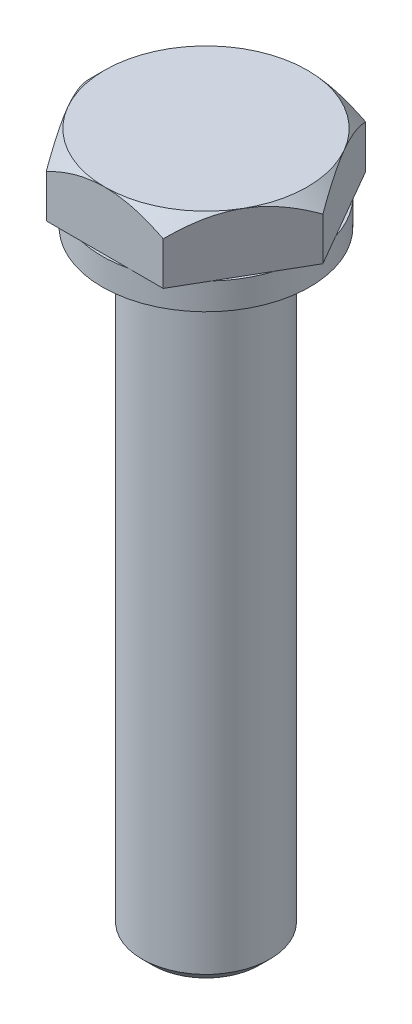
from build123d import *

# Parameters (mm, degrees)
SZKIC1_R                    = 6
DODANIE_WYCI_GNI_CIE1_DEPTH = 60
DODANIE_WYCI_GNI_CIE2_DEPTH = 5.5
SFAZOWANIE1_SIZE            = 1
SZKIC6_R                    = 9.75
SZKIC6_R_2                  = 6.5
DODANIE_WYCI_GNI_CIE3_DEPTH = 2.5


with BuildPart() as part:
    # Szkic1 → Dodanie-wyciągnięcie1 (new body)
    with BuildSketch(Plane(origin=(0, 0, 0), x_dir=(1, 0, 0), z_dir=(0, 1, 0))):
        with Locations(Location((0, 0, 0), (0, 0, 270))):
            Circle(SZKIC1_R)
    extrude(amount=-DODANIE_WYCI_GNI_CIE1_DEPTH)

    # Szkic2 → Dodanie-wyciągnięcie2 (add)
    with BuildSketch(Plane(origin=(0, 0, 0), x_dir=(1, 0, 0), z_dir=(0, 1, 0))):
        Polygon((10.969655115, 0), (5.484827557, 9.5), (-5.484827557, 9.5), (-10.969655115, 0), (-5.484827557, -9.5), (5.484827557, -9.5), align=None)
    extrude(amount=DODANIE_WYCI_GNI_CIE2_DEPTH)

    # Szkic4 → Wycięcie-obrót1 (revolve, cut)
    with BuildSketch(Plane.XY):
        Polygon((10.969655115, 4.030344885), (9.5, 5.5), (10.969655115, 5.5), align=None)
    revolve(axis=Axis((0, 5.5, 0), (0, -1, 0)), mode=Mode.SUBTRACT)

    # Sfazowanie1
    sfazowanie1_edges = [part.edges().sort_by_distance(p)[0] for p in [
        (0, -60, -6),
    ]]
    chamfer(sfazowanie1_edges, length=SFAZOWANIE1_SIZE)

    # Szkic6 → Dodanie-wyciągnięcie3 (add)
    with BuildSketch(Plane.XZ):
        with Locations(Location((0, 0, 0), (0, 0, 76.997175533))):
            Circle(SZKIC6_R)
        with Locations(Location((0, 0, 0), (0, 0, 270))):
            Circle(SZKIC6_R_2, mode=Mode.SUBTRACT)
    extrude(amount=DODANIE_WYCI_GNI_CIE3_DEPTH)


solid = part.part
